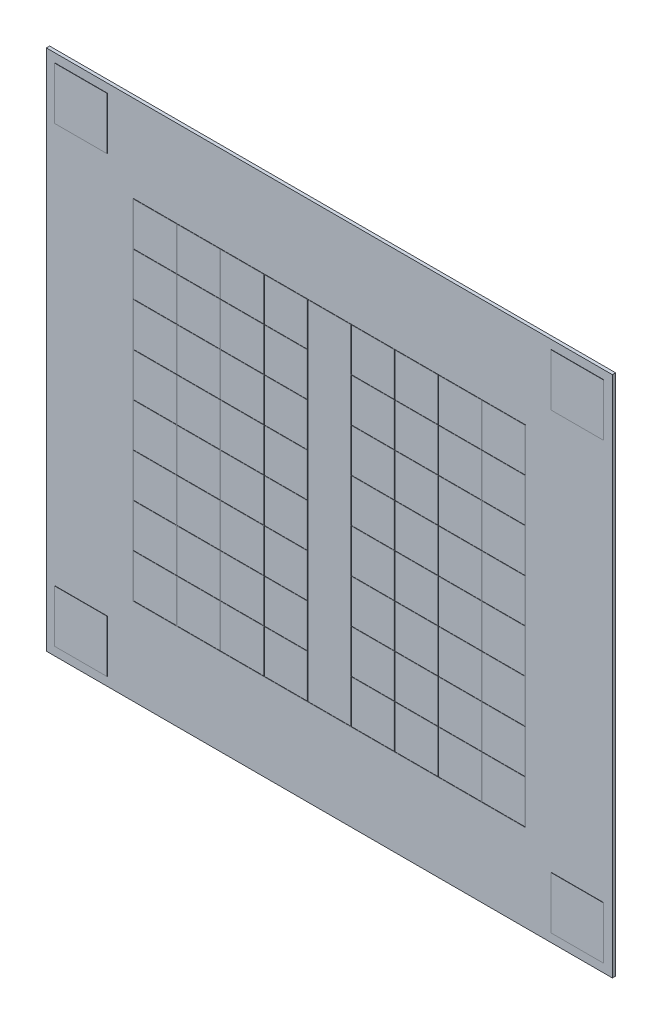
from build123d import *

# Parameters (mm, degrees)
EXTRUDE_START         = -3
SKETCH_1_W            = 520
SKETCH_1_H            = 480
EXTRUDE_520X480_DEPTH = 3
SKETCH_2_W            = 0.4
SKETCH_2_H            = 320
EXTRUDE_499_DEPTH     = 0.2
SKETCH_3_W            = 360
SKETCH_3_H            = 0.4
SKETCH_3_W_2          = 160
EXTRUDE_861_DEPTH     = 0.2
SKETCH_4_W            = 48
SKETCH_4_H            = 48
F_48MM_DEPTH          = 0.3


with BuildPart() as part:
    # 草图1 → 520x480棋盘与码区域 (new body)
    with BuildSketch(Plane.XY.offset(EXTRUDE_START)):
        Rectangle(SKETCH_1_W, SKETCH_1_H)
    extrude(amount=EXTRUDE_520X480_DEPTH)

    # 草图2 → Extrude 499 (add)
    with BuildSketch(Plane.XY):
        with Locations((-180, 0)):
            Rectangle(SKETCH_2_W, SKETCH_2_H)
        with Locations((-140, 0)):
            Rectangle(SKETCH_2_W, SKETCH_2_H)
        with Locations((-100, 0)):
            Rectangle(SKETCH_2_W, SKETCH_2_H)
        with Locations((-60, 0)):
            Rectangle(SKETCH_2_W, SKETCH_2_H)
        with Locations((-20, 0)):
            Rectangle(SKETCH_2_W, SKETCH_2_H)
        with Locations((20, 0)):
            Rectangle(SKETCH_2_W, SKETCH_2_H)
        with Locations((60, 0)):
            Rectangle(SKETCH_2_W, SKETCH_2_H)
        with Locations((100, 0)):
            Rectangle(SKETCH_2_W, SKETCH_2_H)
        with Locations((140, 0)):
            Rectangle(SKETCH_2_W, SKETCH_2_H)
        with Locations((180, 0)):
            Rectangle(SKETCH_2_W, SKETCH_2_H)
    extrude(amount=EXTRUDE_499_DEPTH)

    # 草图3 → Extrude 861 (add)
    with BuildSketch(Plane.XY):
        with Locations((0, -160)):
            Rectangle(SKETCH_3_W, SKETCH_3_H)
        with Locations((-100, -120)):
            Rectangle(SKETCH_3_W_2, SKETCH_3_H)
        with Locations((100, -120)):
            Rectangle(SKETCH_3_W_2, SKETCH_3_H)
        with Locations((-100, -80)):
            Rectangle(SKETCH_3_W_2, SKETCH_3_H)
        with Locations((100, -80)):
            Rectangle(SKETCH_3_W_2, SKETCH_3_H)
        with Locations((-100, -40)):
            Rectangle(SKETCH_3_W_2, SKETCH_3_H)
        with Locations((100, -40)):
            Rectangle(SKETCH_3_W_2, SKETCH_3_H)
        with Locations((-100, 0)):
            Rectangle(SKETCH_3_W_2, SKETCH_3_H)
        with Locations((100, 0)):
            Rectangle(SKETCH_3_W_2, SKETCH_3_H)
        with Locations((-100, 40)):
            Rectangle(SKETCH_3_W_2, SKETCH_3_H)
        with Locations((100, 40)):
            Rectangle(SKETCH_3_W_2, SKETCH_3_H)
        with Locations((-100, 80)):
            Rectangle(SKETCH_3_W_2, SKETCH_3_H)
        with Locations((100, 80)):
            Rectangle(SKETCH_3_W_2, SKETCH_3_H)
        with Locations((-100, 120)):
            Rectangle(SKETCH_3_W_2, SKETCH_3_H)
        with Locations((100, 120)):
            Rectangle(SKETCH_3_W_2, SKETCH_3_H)
        with Locations((0, 160)):
            Rectangle(SKETCH_3_W, SKETCH_3_H)
    extrude(amount=EXTRUDE_861_DEPTH)

    # 草图4 → 四块48mm角标位置 (add)
    with BuildSketch(Plane.XY):
        with Locations((-228, -208)):
            Rectangle(SKETCH_4_W, SKETCH_4_H)
        with Locations((-228, 208)):
            Rectangle(SKETCH_4_W, SKETCH_4_H)
        with Locations((228, -208)):
            Rectangle(SKETCH_4_W, SKETCH_4_H)
        with Locations((228, 208)):
            Rectangle(SKETCH_4_W, SKETCH_4_H)
    extrude(amount=F_48MM_DEPTH)


solid = part.part
